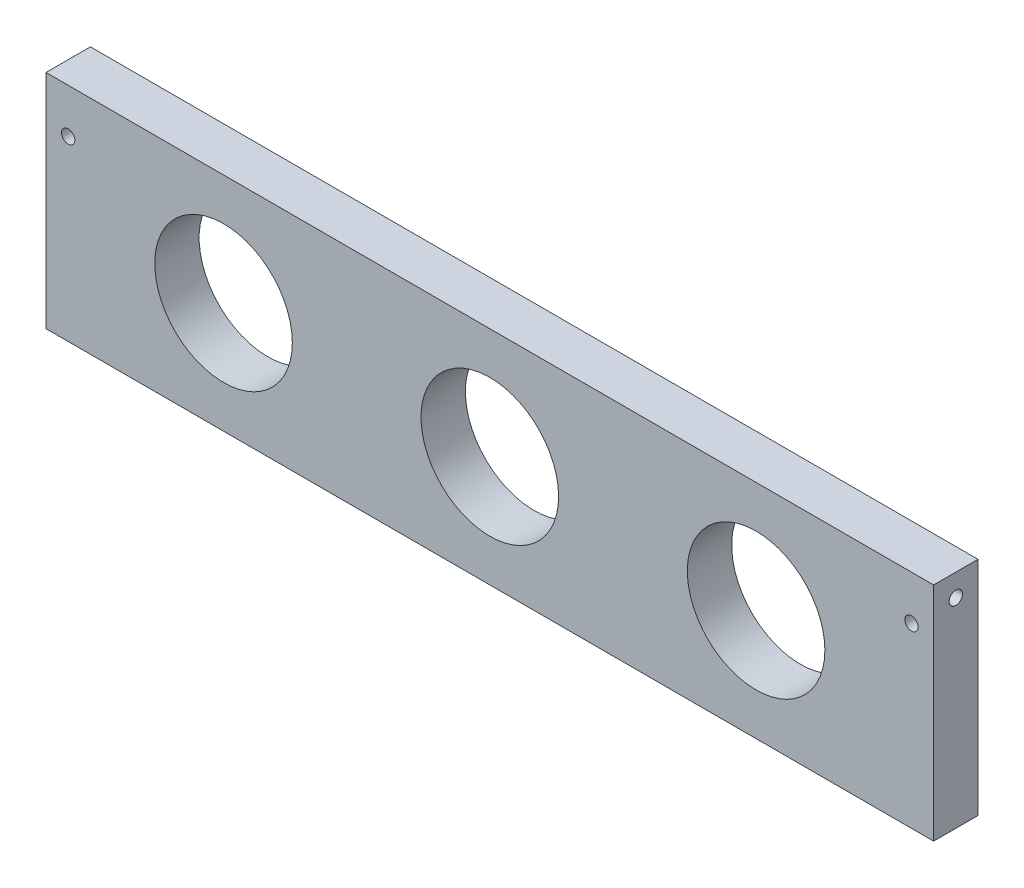
from build123d import *

# Parameters (mm, degrees)
SKETCH1_W           = 200
SKETCH1_H           = 50
SKETCH1_R           = 15.5
SKETCH1_R_2         = 1.5
BOSS_EXTRUDE1_DEPTH = 10
SKETCH2_R           = 2.5
CUT_EXTRUDE1_DEPTH  = 10
SKETCH3_R           = 1.5
CUT_EXTRUDE2_DEPTH  = 200


with BuildPart() as part:
    # Sketch1 → Boss-Extrude1 (new body)
    with BuildSketch(Plane.XY):
        Rectangle(SKETCH1_W, SKETCH1_H)
        Circle(SKETCH1_R, mode=Mode.SUBTRACT)
        with Locations((60, 0)):
            Circle(SKETCH1_R, mode=Mode.SUBTRACT)
        with Locations((-60, 0)):
            Circle(SKETCH1_R, mode=Mode.SUBTRACT)
        with Locations((95, 15)):
            Circle(SKETCH1_R_2, mode=Mode.SUBTRACT)
        with Locations((-95, 15)):
            Circle(SKETCH1_R_2, mode=Mode.SUBTRACT)
    extrude(amount=BOSS_EXTRUDE1_DEPTH)

    # Sketch2 → Cut-Extrude1 (cut)
    with BuildSketch(Plane.XZ.offset(25)):
        with Locations(Location((-95, 5, 0), (0, 0, 270))):
            Circle(SKETCH2_R)
        with Locations(Location((95, 5, 0), (0, 0, 270))):
            Circle(SKETCH2_R)
    extrude(amount=-CUT_EXTRUDE1_DEPTH, mode=Mode.SUBTRACT)

    # Sketch3 → Cut-Extrude2 (cut)
    with BuildSketch(Plane(origin=(100, 0, 0), x_dir=(0, 0, -1), z_dir=(1, 0, 0))):
        with Locations((-5, 20)):
            Circle(SKETCH3_R)
    extrude(amount=-CUT_EXTRUDE2_DEPTH, mode=Mode.SUBTRACT)


solid = part.part
